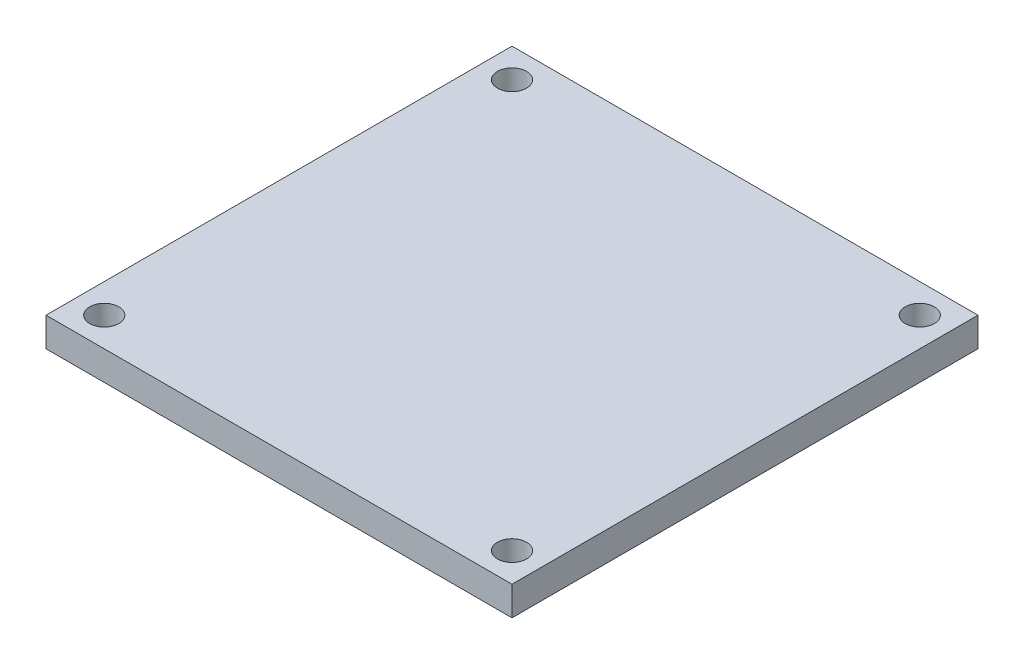
from build123d import *

# Parameters (mm, degrees)
SKETCH1_W           = 50.8
SKETCH1_H           = 50.8
BOSS_EXTRUDE1_DEPTH = 3.175
SKETCH2_R           = 1.5875
CUT_EXTRUDE1_DEPTH  = 37.061067996


with BuildPart() as part:
    # Sketch1 → Boss-Extrude1 (new body)
    with BuildSketch(Plane(origin=(0, 0, 0), x_dir=(1, 0, 0), z_dir=(0, 1, 0))):
        Rectangle(SKETCH1_W, SKETCH1_H)
    extrude(amount=BOSS_EXTRUDE1_DEPTH)

    # Sketch2 → Cut-Extrude1 (cut, through all)
    with BuildSketch(Plane(origin=(0, 3.175, 0), x_dir=(1, 0, 0), z_dir=(0, 1, 0))):
        with Locations(Location((-22.225, -22.225, 0), (0, 0, 270))):
            Circle(SKETCH2_R)
        with Locations(Location((22.225, -22.225, 0), (0, 0, 90))):
            Circle(SKETCH2_R)
        with Locations(Location((22.225, 22.225, 0), (0, 0, 270))):
            Circle(SKETCH2_R)
        with Locations(Location((-22.225, 22.225, 0), (0, 0, 90))):
            Circle(SKETCH2_R)
    extrude(amount=-CUT_EXTRUDE1_DEPTH, mode=Mode.SUBTRACT)


solid = part.part
